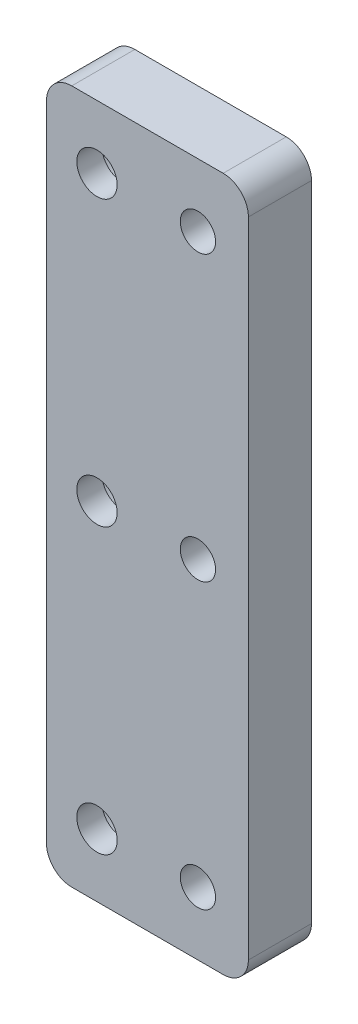
from build123d import *

# Parameters (mm, degrees)
BOSS_EXTRUDE1_DEPTH                    = 2.5
BOSS_EXTRUDE1_DEPTH_BACK               = 2.5
SKETCH1_W                              = 8
SKETCH1_H                              = 55
SKETCH2_R                              = 1.6
CUT_EXTRUDE1_DEPTH                     = 29.235615807
SKETCH3_W                              = 8
SKETCH3_H                              = 55
SKETCH3_R                              = 1.4
BOSS_EXTRUDE3_DEPTH                    = 5
CBORE_FOR_M5_HEX_HEAD_BOLT3_AT_2_COUNT = 2
CBORE_FOR_M5_HEX_HEAD_BOLT3_AT_2_PITCH = 22.5
CBORE_FOR_M5_HEX_HEAD_BOLT3_AT_3_COUNT = 2
CBORE_FOR_M5_HEX_HEAD_BOLT3_AT_3_PITCH = 45
CBORE_FOR_M5_HEX_HEAD_BOLT3_AT_4_COUNT = 2
CBORE_FOR_M5_HEX_HEAD_BOLT3_AT_4_PITCH = 22.5
FILLET1_R                              = 2


with BuildPart() as part:
    # Sketch1 → Boss-Extrude1 (new, two sides: drawn at the far end of the back side and taken through both)
    with BuildSketch(Plane.XY.offset(-BOSS_EXTRUDE1_DEPTH_BACK)):
        Rectangle(SKETCH1_W, SKETCH1_H)
    extrude(amount=BOSS_EXTRUDE1_DEPTH + BOSS_EXTRUDE1_DEPTH_BACK)

    # Sketch2 → Cut-Extrude1 (cut, through all)
    with BuildSketch(Plane.XY.offset(2.5)):
        with Locations((0, 22.5)):
            Circle(SKETCH2_R)
        with Locations((0, -22.5)):
            Circle(SKETCH2_R)
        Circle(SKETCH2_R)
    extrude(amount=-CUT_EXTRUDE1_DEPTH, mode=Mode.SUBTRACT)

    # Sketch3 → Boss-Extrude3 (add, through all)
    with BuildSketch(Plane.XY.offset(2.5)):
        with Locations((8, 0)):
            Rectangle(SKETCH3_W, SKETCH3_H)
        with Locations((8, 22.5)):
            Circle(SKETCH3_R, mode=Mode.SUBTRACT)
        with Locations((8, 0)):
            Circle(SKETCH3_R, mode=Mode.SUBTRACT)
        with Locations((8, -22.5)):
            Circle(SKETCH3_R, mode=Mode.SUBTRACT)
    extrude(amount=-BOSS_EXTRUDE3_DEPTH)

    # Sketch8 → CBORE for M5 Hex Head Bolt3 (revolve, cut)
    with BuildSketch(Plane(origin=(0, 22.5, -2.5), x_dir=(0, 1, 0), z_dir=(1, 0, 0))):
        Polygon((0, 0), (0, 5), (1.6, 5), (1.6, 3), (3.5, 3), (3.5, 0), align=None)
    cbore_for_m5_hex_head_bolt3 = revolve(axis=Axis((0, 22.5, -8.85), (0, 0, 1)), mode=Mode.SUBTRACT)

    # CBORE for M5 Hex Head Bolt3 at 2: CBORE for M5 Hex Head Bolt3 ×2
    with Locations(*[(0, -i * CBORE_FOR_M5_HEX_HEAD_BOLT3_AT_2_PITCH, 0) for i in range(1, CBORE_FOR_M5_HEX_HEAD_BOLT3_AT_2_COUNT)]):
        add(cbore_for_m5_hex_head_bolt3, mode=Mode.SUBTRACT)

    # CBORE for M5 Hex Head Bolt3 at 3: CBORE for M5 Hex Head Bolt3 ×2
    with Locations(*[(0, -i * CBORE_FOR_M5_HEX_HEAD_BOLT3_AT_3_PITCH, 0) for i in range(1, CBORE_FOR_M5_HEX_HEAD_BOLT3_AT_3_COUNT)]):
        add(cbore_for_m5_hex_head_bolt3, mode=Mode.SUBTRACT)

    # CBORE for M5 Hex Head Bolt3 at 4: CBORE for M5 Hex Head Bolt3 ×2
    with Locations(*[(0, -i * CBORE_FOR_M5_HEX_HEAD_BOLT3_AT_4_PITCH, 0) for i in range(1, CBORE_FOR_M5_HEX_HEAD_BOLT3_AT_4_COUNT)]):
        add(cbore_for_m5_hex_head_bolt3, mode=Mode.SUBTRACT)

    # Fillet1
    fillet1_edges = [part.edges().sort_by_distance(p)[0] for p in [
        (12, 27.5, 0),
        (12, -27.5, 0),
        (-4, -27.5, 0),
        (-4, 27.5, 0),
    ]]
    fillet(fillet1_edges, radius=FILLET1_R)


solid = part.part
